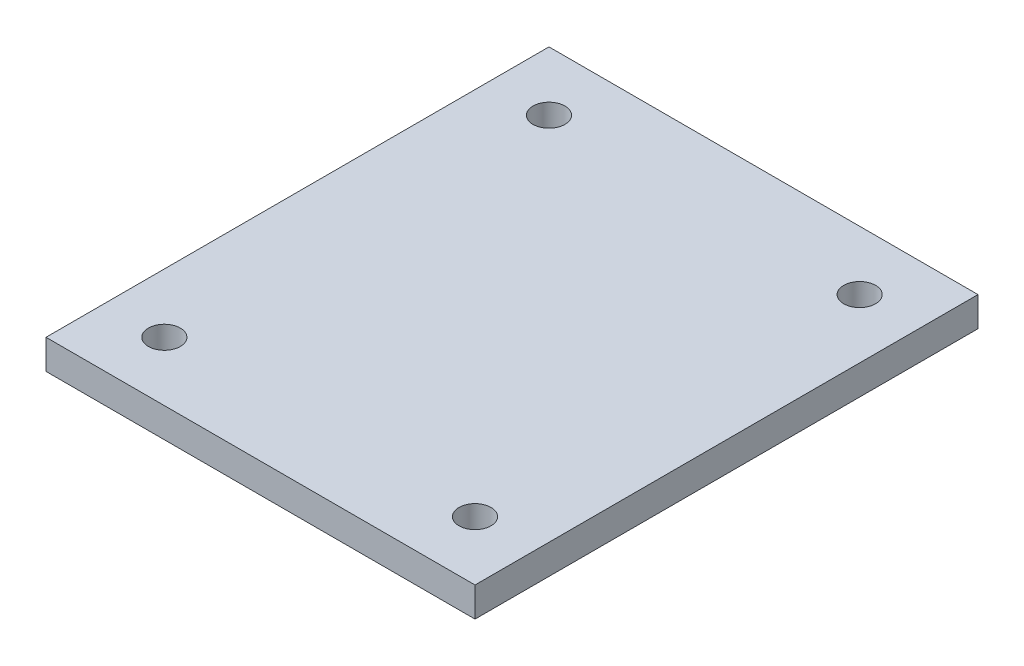
from build123d import *

# Parameters (mm, degrees)
SKETCH1_W           = 92.075
SKETCH1_H           = 107.95
BOSS_EXTRUDE1_DEPTH = 6.35
CUT_EXTRUDE2_REACH  = 73.226
SKETCH3_R           = 3.429


with BuildPart() as part:
    # Sketch1 → Boss-Extrude1 (new body)
    with BuildSketch(Plane(origin=(0, 0, 0), x_dir=(1, 0, 0), z_dir=(0, 1, 0))):
        Rectangle(SKETCH1_W, SKETCH1_H)
    extrude(amount=BOSS_EXTRUDE1_DEPTH)

    # Sketch3 → Cut-Extrude2 (cut, up to next)
    with BuildSketch(Plane.XZ, mode=Mode.PRIVATE) as cut_extrude2_sk1:
        with Locations(Location((-33.3375, 41.275, 0), (0, 0, 270))):
            Circle(SKETCH3_R)
    cut_extrude2_tool1 = extrude(cut_extrude2_sk1.sketch, amount=-CUT_EXTRUDE2_REACH, mode=Mode.PRIVATE) & part.part
    # Sketch3 → Cut-Extrude2 (cut, up to next)
    with BuildSketch(Plane.XZ, mode=Mode.PRIVATE) as cut_extrude2_sk2:
        with Locations(Location((-33.3375, -41.275, 0), (0, 0, 90))):
            Circle(SKETCH3_R)
    cut_extrude2_tool2 = extrude(cut_extrude2_sk2.sketch, amount=-CUT_EXTRUDE2_REACH, mode=Mode.PRIVATE) & part.part
    # Sketch3 → Cut-Extrude2 (cut, up to next)
    with BuildSketch(Plane.XZ, mode=Mode.PRIVATE) as cut_extrude2_sk3:
        with Locations(Location((33.3375, 41.275, 0), (0, 0, 90))):
            Circle(SKETCH3_R)
    cut_extrude2_tool3 = extrude(cut_extrude2_sk3.sketch, amount=-CUT_EXTRUDE2_REACH, mode=Mode.PRIVATE) & part.part
    # Sketch3 → Cut-Extrude2 (cut, up to next)
    with BuildSketch(Plane.XZ, mode=Mode.PRIVATE) as cut_extrude2_sk4:
        with Locations(Location((33.3375, -41.275, 0), (0, 0, 270))):
            Circle(SKETCH3_R)
    cut_extrude2_tool4 = extrude(cut_extrude2_sk4.sketch, amount=-CUT_EXTRUDE2_REACH, mode=Mode.PRIVATE) & part.part
    add(cut_extrude2_tool1.solids().sort_by_distance((-33.3375, 0, 41.275))[0], mode=Mode.SUBTRACT)
    add(cut_extrude2_tool2.solids().sort_by_distance((-33.3375, 0, -41.275))[0], mode=Mode.SUBTRACT)
    add(cut_extrude2_tool3.solids().sort_by_distance((33.3375, 0, 41.275))[0], mode=Mode.SUBTRACT)
    add(cut_extrude2_tool4.solids().sort_by_distance((33.3375, 0, -41.275))[0], mode=Mode.SUBTRACT)


solid = part.part
